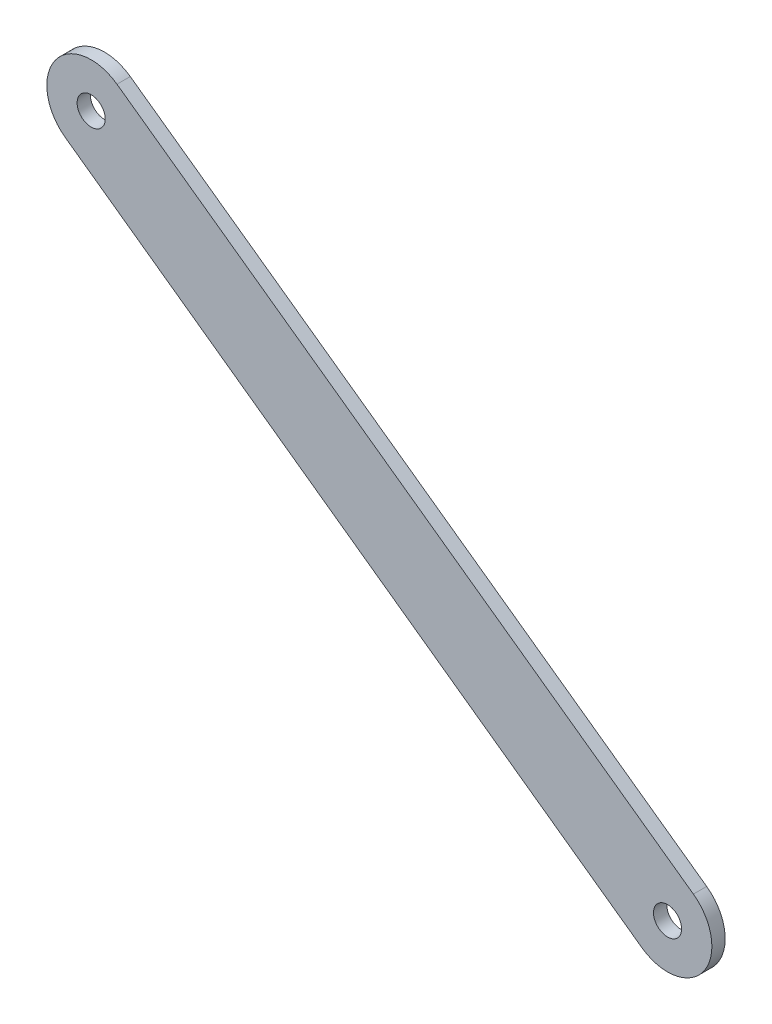
from build123d import *

# Parameters (mm, degrees)
SKETCH1_R           = 3.167656389
BOSS_EXTRUDE1_DEPTH = 3


with BuildPart() as part:
    # Sketch1 → Boss-Extrude1 (new body)
    with BuildSketch(Plane.XY):
        with BuildLine():
            Line((77.574998275, 60.151647429), (207.615833961, -33.065202197))
            ThreePointArc((207.615833961, -33.065202197), (221.569439293, -30.763703069), (219.267940164, -16.810097737))
            Line((219.267940164, -16.810097737), (89.227104478, 76.406751889))
            ThreePointArc((89.227104478, 76.406751889), (75.273499146, 74.105252761), (77.574998275, 60.151647429))
        make_face()
        with Locations((83.401051377, 68.279199659)):
            Circle(SKETCH1_R, mode=Mode.SUBTRACT)
        with Locations((213.441887062, -24.937649967)):
            Circle(SKETCH1_R, mode=Mode.SUBTRACT)
    extrude(amount=BOSS_EXTRUDE1_DEPTH)


solid = part.part
